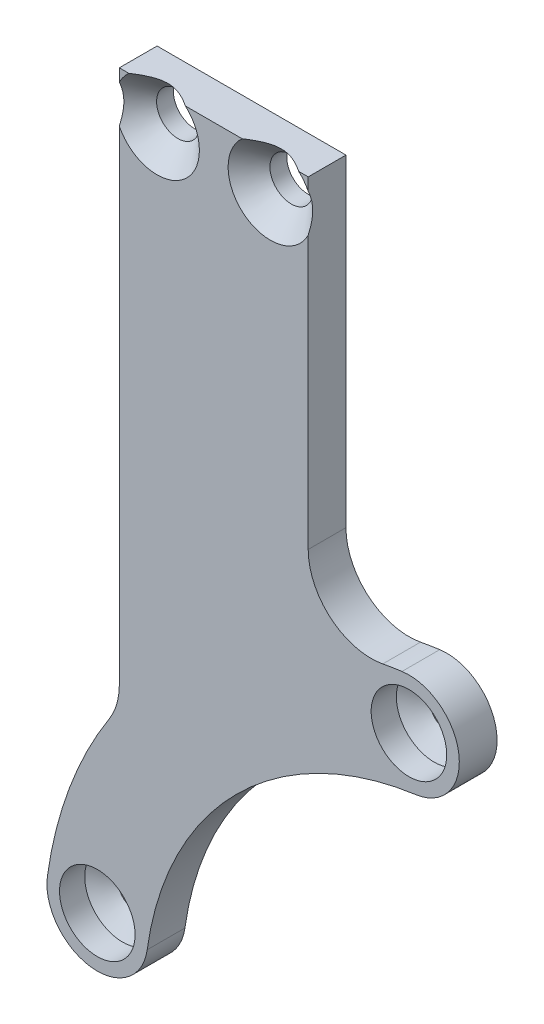
from build123d import *

# Parameters (mm, degrees)
RESSALTO_EXTRUS_O2_DEPTH                  = 3
BROCA_DE_ROSQUEAR_PARA_TARRAXA_DE_M2_51_D = 2.05
FURO_DE_DI_METRO_6_0_6_2_D                = 6
FURO_DE_DI_METRO_6_0_6_2_DEPTH            = 2
FURO_DE_DI_METRO_6_0_6_2_TIP              = 1.802581857
ESCAREADO_PARA_SFHCS_M31_AT_2_COUNT       = 2
ESCAREADO_PARA_SFHCS_M31_AT_2_PITCH       = 9
FILETE1_R                                 = 5


with BuildPart() as part:
    # Esboço1 → Ressalto-extrusão2 (new body)
    with BuildSketch(Plane.XY):
        with BuildLine():
            Line((-12, 30.768414179), (-12, 63))
            Line((-12, 63), (-27, 63))
            Line((-27, 63), (-27, 19.018288858))
            ThreePointArc((-27, 19.018288858), (-30.719082421, 12.125728279), (-32.710572622, 4.551236075))
            ThreePointArc((-32.710572622, 4.551236075), (-29.299973416, 0.038164719), (-24.786902061, 3.448763925))
            ThreePointArc((-24.786902061, 3.448763925), (-17.695825587, 17.695825587), (-3.448763925, 24.786902061))
            ThreePointArc((-3.448763925, 24.786902061), (-0.038164719, 29.299973416), (-4.551236075, 32.710572622))
            ThreePointArc((-4.551236075, 32.710572622), (-8.332397539, 31.957259931), (-12, 30.768414179))
        make_face()
    extrude(amount=RESSALTO_EXTRUS_O2_DEPTH)

    # Broca de rosquear para tarraxa de M2.51 (through all)
    with Locations(Plane.XY.offset(3)):
        with Locations((-28.748737342, 4), (-4, 28.748737342)):
            Hole(BROCA_DE_ROSQUEAR_PARA_TARRAXA_DE_M2_51_D / 2)

    # Furo de diâmetro Ø6.0 (6)2
    with Locations(Plane.XY.offset(3)):
        with Locations((-28.748737342, 4), (-4, 28.748737342)):
            Hole(FURO_DE_DI_METRO_6_0_6_2_D / 2, depth=FURO_DE_DI_METRO_6_0_6_2_DEPTH)
            with Locations((0, 0, -(FURO_DE_DI_METRO_6_0_6_2_DEPTH + FURO_DE_DI_METRO_6_0_6_2_TIP / 2))):  # 118° drill point
                Cone(0, FURO_DE_DI_METRO_6_0_6_2_D / 2, FURO_DE_DI_METRO_6_0_6_2_TIP, mode=Mode.SUBTRACT)

    # Esboço13 → Escareado para SFHCS M31 (revolve, cut)
    with BuildSketch(Plane(origin=(-24, 60.5, 3), x_dir=(0, -1, 0), z_dir=(1, 0, 0))):
        Polygon((0, 0), (0, 3), (1.7, 3), (1.7, 1.66), (3.36, 0), align=None)
    escareado_para_sfhcs_m31 = revolve(axis=Axis((-24, 60.5, 9.35), (0, 0, -1)), mode=Mode.SUBTRACT)

    # Escareado para SFHCS M31 at 2: Escareado para SFHCS M31 ×2
    with Locations(*[(i * ESCAREADO_PARA_SFHCS_M31_AT_2_PITCH, 0, 0) for i in range(1, ESCAREADO_PARA_SFHCS_M31_AT_2_COUNT)]):
        add(escareado_para_sfhcs_m31, mode=Mode.SUBTRACT)

    # Filete1
    filete1_edges = [part.edges().sort_by_distance(p)[0] for p in [
        (-27, 19.018288858, 1.5),
        (-12, 30.768414179, 1.5),
    ]]
    fillet(filete1_edges, radius=FILETE1_R)


solid = part.part
